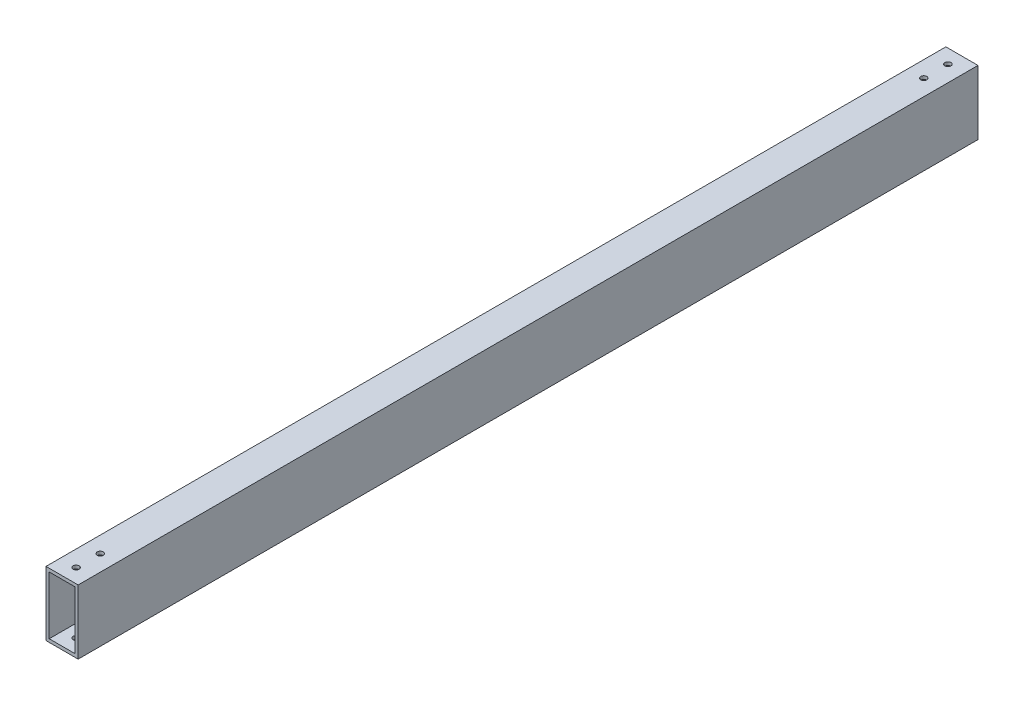
from build123d import *

# Parameters (mm, degrees)
SKETCH1_W           = 25.4
SKETCH1_H           = 50.8
BOSS_EXTRUDE1_DEPTH = 355.6
SHELL1_T            = -2.54
SKETCH2_R           = 2.38125
CUT_EXTRUDE1_DEPTH  = 360.434681131


with BuildPart() as part:
    # Sketch1 → Boss-Extrude1 (new, symmetric)
    with BuildSketch(Plane.XY):
        Rectangle(SKETCH1_W, SKETCH1_H)
    extrude(amount=BOSS_EXTRUDE1_DEPTH, both=True)

    # Shell1
    shell1_openings = [part.faces().sort_by_distance(p)[0] for p in [
        (0, 0, 355.6),
        (0, 0, -355.6),
    ]]
    offset(amount=SHELL1_T, openings=shell1_openings, kind=Kind.INTERSECTION)

    # Sketch2 → Cut-Extrude1 (cut, through all)
    with BuildSketch(Plane.XZ.offset(25.4)):
        with Locations(Location((0, 344.4875, 0), (0, 0, 270))):
            Circle(SKETCH2_R)
        with Locations(Location((0, 325.4375, 0), (0, 0, 270))):
            Circle(SKETCH2_R)
        with Locations(Location((0, -325.4375, 0), (0, 0, 270))):
            Circle(SKETCH2_R)
        with Locations(Location((0, -344.4875, 0), (0, 0, 270))):
            Circle(SKETCH2_R)
    extrude(amount=-CUT_EXTRUDE1_DEPTH, mode=Mode.SUBTRACT)


solid = part.part
